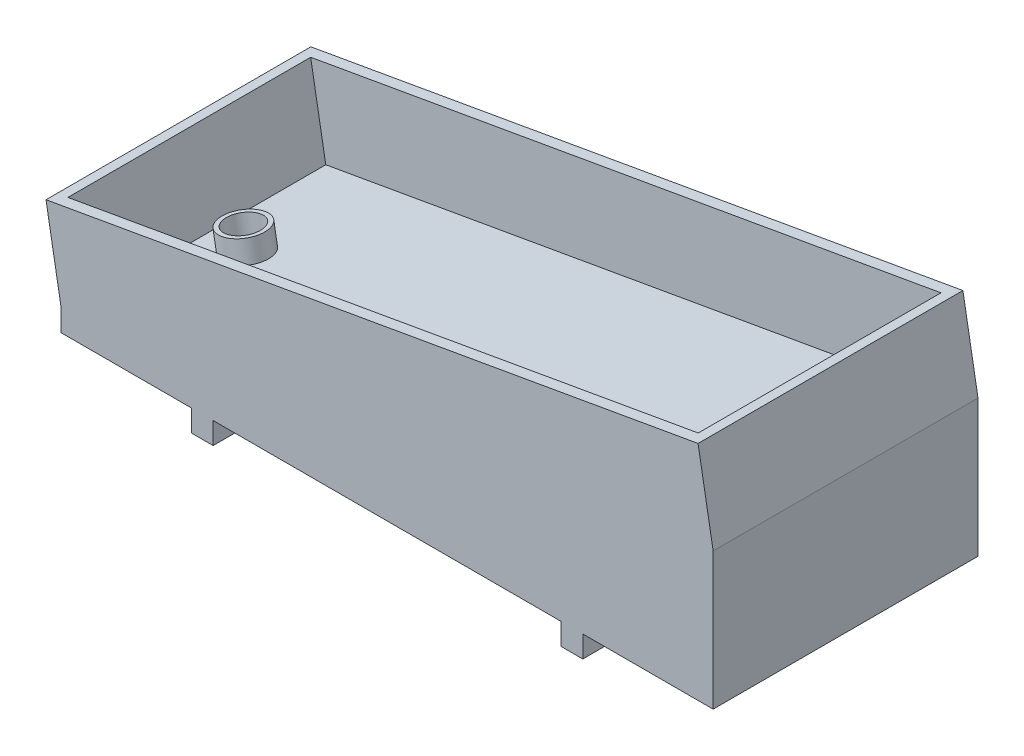
from build123d import *

# Parameters (mm, degrees)
SKETCH1_W           = 1500.847015591
SKETCH1_H           = 50.8
BOSS_EXTRUDE2_DEPTH = 609.6
SKETCH3_W           = 1473.2
SKETCH3_H           = 558.8
BOSS_EXTRUDE4_DEPTH = 200
SKETCH4_R           = 50
BOSS_EXTRUDE5_DEPTH = 50
SKETCH5_R           = 40
CUT_EXTRUDE3_DEPTH  = 200
BOSS_EXTRUDE6_DEPTH = 50


with BuildPart() as part:
    # Sketch1 → Boss-Extrude2 (new body)
    with BuildSketch(Plane.XY):
        Polygon((0, 0), (1500.847015591, 0), (1500.847015591, 264.639822764), align=None)
        with Locations((750.423507796, -25.4)):
            Rectangle(SKETCH1_W, SKETCH1_H)
    extrude(amount=BOSS_EXTRUDE2_DEPTH)

    # Sketch3 → Boss-Extrude4 (add)
    with BuildSketch(Plane(origin=(0, 0, 0), x_dir=(0.9848077530122079, 0.17364817766693136, 0), z_dir=(-0.17364817766693136, 0.9848077530122079, 0))):
        Polygon((1524, 0), (0, 0), (0, -25.4), (0, -609.6), (1524, -609.6), align=None)
        with Locations((762, -304.8)):
            Rectangle(SKETCH3_W, SKETCH3_H, mode=Mode.SUBTRACT)
    extrude(amount=BOSS_EXTRUDE4_DEPTH)

    # Sketch4 → Boss-Extrude5 (add)
    with BuildSketch(Plane(origin=(0, 0, 0), x_dir=(0.9848077530122079, 0.17364817766693136, 0), z_dir=(-0.17364817766693136, 0.9848077530122079, 0))):
        with Locations(Location((125.4, -304.8, 0), (0, 0, 180))):
            Circle(SKETCH4_R)
    extrude(amount=BOSS_EXTRUDE5_DEPTH)

    # Sketch5 → Cut-Extrude3 (cut)
    with BuildSketch(Plane(origin=(-8.682408883, 49.240387651, 0), x_dir=(0.9848077530122079, 0.17364817766693136, 0), z_dir=(-0.17364817766693136, 0.9848077530122079, 0))):
        with Locations(Location((125.4, -304.8, 0), (0, 0, 180))):
            Circle(SKETCH5_R)
    extrude(amount=-CUT_EXTRUDE3_DEPTH, mode=Mode.SUBTRACT)

    # Sketch6 → Boss-Extrude6 (add)
    with BuildSketch(Plane(origin=(0, -50.8, 0), x_dir=(-1, 0, 0), z_dir=(0, -1, 0))):
        Polygon((-350, 0), (-350, -609.6), (-300, -609.6), (-300, -304.8), (-300, 0), align=None)
        Polygon((-1200.847015591, 0), (-1200.847015591, -304.8), (-1200.847015591, -609.6), (-1150.847015591, -609.6), (-1150.847015591, 0), align=None)
    extrude(amount=BOSS_EXTRUDE6_DEPTH)


solid = part.part
